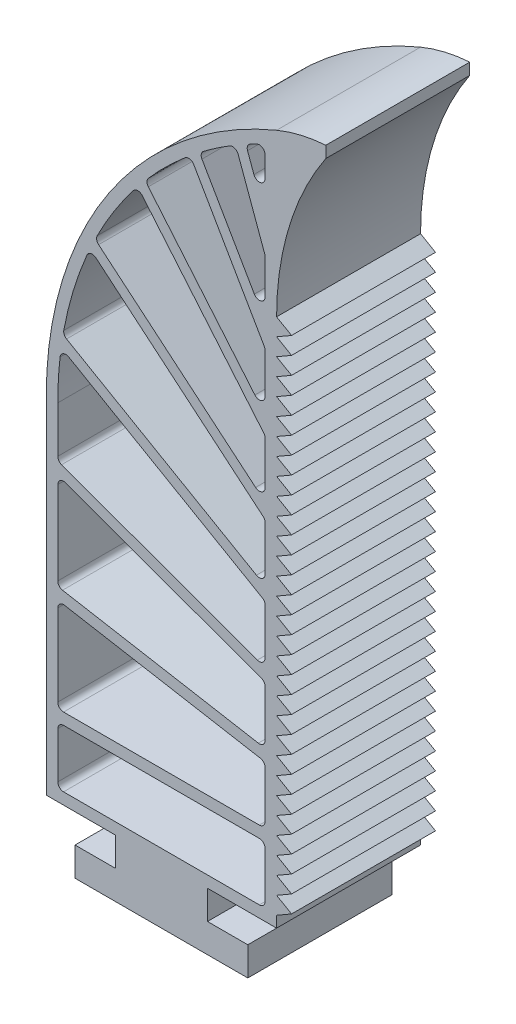
from build123d import *

# Parameters (mm, degrees)
BOSS_EXTRUDE1_DEPTH = 25
SKETCH3_W           = 36
SKETCH3_H           = 10
CUT_EXTRUDE1_DEPTH  = 134.88427839
CUT_EXTRUDE2_DEPTH  = 134.88427839
CUT_EXTRUDE3_DEPTH  = 134.88427839
CUT_EXTRUDE4_DEPTH  = 134.88427839
BOSS_EXTRUDE2_DEPTH = 25
BOSS_EXTRUDE3_DEPTH = 25
LPATTERN1_COUNT     = 30
LPATTERN1_PITCH     = 3
CUT_EXTRUDE5_DEPTH  = 138.359842306
CUT_EXTRUDE6_DEPTH  = 138.359842306
CUT_EXTRUDE7_DEPTH  = 138.359842306
CUT_EXTRUDE8_DEPTH  = 138.359842306
CUT_EXTRUDE9_DEPTH  = 138.359842306
FILLET1_R           = 1


with BuildPart() as part:
    # Sketch2 → Boss-Extrude1 (new body)
    with BuildSketch(Plane.XY):
        with BuildLine():
            Line((-15, 0), (15, 0))
            Line((15, 0), (15, 5))
            Line((15, 5), (8, 5))
            Line((8, 5), (8, 10))
            Line((8, 10), (20, 10))
            Line((20, 10), (20, 130))
            ThreePointArc((20, 130), (-9.083269132, 106.055512755), (-20, 70))
            Line((-20, 70), (-20, 10))
            Line((-20, 10), (-8, 10))
            Line((-8, 10), (-8, 5))
            Line((-8, 5), (-15, 5))
            Line((-15, 5), (-15, 0))
        make_face()
    extrude(amount=BOSS_EXTRUDE1_DEPTH)

    # Sketch3 → Cut-Extrude1 (cut, through all)
    with BuildSketch(Plane.XY.offset(25)):
        with Locations((0, 17)):
            Rectangle(SKETCH3_W, SKETCH3_H)
    extrude(amount=-CUT_EXTRUDE1_DEPTH, mode=Mode.SUBTRACT)

    # Sketch4 → Cut-Extrude2 (cut, through all)
    with BuildSketch(Plane.XY.offset(25)):
        Polygon((-18, 24), (18, 24), (18, 34), (-18, 40.347771306), align=None)
    extrude(amount=-CUT_EXTRUDE2_DEPTH, mode=Mode.SUBTRACT)

    # Sketch5 → Cut-Extrude3 (cut, through all)
    with BuildSketch(Plane.XY.offset(25)):
        Polygon((-18, 42.378624529), (18, 36.030853224), (18, 46.030853224), (-18, 59.133781657), align=None)
    extrude(amount=-CUT_EXTRUDE3_DEPTH, mode=Mode.SUBTRACT)

    # Sketch6 → Cut-Extrude4 (cut, through all)
    with BuildSketch(Plane.XY.offset(25)):
        with BuildLine():
            Line((-18, 61.262137202), (18, 48.159208769))
            Line((18, 48.159208769), (18, 58.159208769))
            Line((18, 58.159208769), (-17.409830527, 78.603083956))
            ThreePointArc((-17.409830527, 78.603083956), (-17.852284458, 74.311651469), (-18, 70))
            Line((-18, 70), (-18, 61.262137202))
        make_face()
    extrude(amount=-CUT_EXTRUDE4_DEPTH, mode=Mode.SUBTRACT)

    # Sketch13 → Boss-Extrude2 (add)
    with BuildSketch(Plane.XY.offset(25)):
        with BuildLine():
            Line((28.543587015, 132.015112463), (28.543587015, 130.015112463))
            ThreePointArc((28.543587015, 130.015112463), (22.183163486, 116.610368534), (20, 101.934676234))
            Line((20, 101.934676234), (20, 130))
            ThreePointArc((20, 130), (24.189413282, 131.356828362), (28.543587015, 132.015112463))
        make_face()
    extrude(amount=-BOSS_EXTRUDE2_DEPTH)

    # Sketch15 → Boss-Extrude3 (add)
    with BuildSketch(Plane.XY.offset(25)):
        Polygon((20, 101.934676234), (22.598076211, 100.434676234), (20, 98.934676234), align=None)
    boss_extrude3 = extrude(amount=-BOSS_EXTRUDE3_DEPTH)

    # LPattern1: Boss-Extrude3 ×30
    with Locations(*[(0, -i * LPATTERN1_PITCH, 0) for i in range(1, LPATTERN1_COUNT)]):
        add(boss_extrude3)

    # Sketch17 → Cut-Extrude5 (cut, through all)
    with BuildSketch(Plane.XY.offset(25)):
        with BuildLine():
            Line((-17.080813578, 80.722527008), (18, 60.468609845))
            Line((18, 60.468609845), (18, 70.468609845))
            Line((18, 70.468609845), (-12.396357526, 95.974182235))
            ThreePointArc((-12.396357526, 95.974182235), (-15.223349712, 88.497247077), (-17.080813578, 80.722527008))
        make_face()
    extrude(amount=-CUT_EXTRUDE5_DEPTH, mode=Mode.SUBTRACT)

    # Sketch18 → Cut-Extrude6 (cut, through all)
    with BuildSketch(Plane.XY.offset(25)):
        with BuildLine():
            Line((-11.513032555, 97.843799156), (18, 73.079424424))
            Line((18, 73.079424424), (18, 83.079424424))
            Line((18, 83.079424424), (-4.123287406, 109.44493167))
            ThreePointArc((-4.123287406, 109.44493167), (-8.135718614, 103.846645438), (-11.513032555, 97.843799156))
        make_face()
    extrude(amount=-CUT_EXTRUDE6_DEPTH, mode=Mode.SUBTRACT)

    # Sketch19 → Cut-Extrude7 (cut, through all)
    with BuildSketch(Plane.XY.offset(25)):
        with BuildLine():
            Line((-2.825102167, 111.009262402), (18, 86.190872078))
            Line((18, 86.190872078), (18, 96.190872078))
            Line((18, 96.190872078), (5.013768012, 118.68368568))
            ThreePointArc((5.013768012, 118.68368568), (0.926972027, 115.017421131), (-2.825102167, 111.009262402))
        make_face()
    extrude(amount=-CUT_EXTRUDE7_DEPTH, mode=Mode.SUBTRACT)

    # Sketch21 → Cut-Extrude8 (cut, through all)
    with BuildSketch(Plane.XY.offset(25)):
        with BuildLine():
            Line((6.596754137, 119.941873284), (18, 100.190872078))
            Line((18, 100.190872078), (18, 110.190872078))
            Line((18, 110.190872078), (12.898276405, 124.207742456))
            ThreePointArc((12.898276405, 124.207742456), (9.683048128, 122.170038436), (6.596754137, 119.941873284))
        make_face()
    extrude(amount=-CUT_EXTRUDE8_DEPTH, mode=Mode.SUBTRACT)

    # Sketch22 → Cut-Extrude9 (cut, through all)
    with BuildSketch(Plane.XY.offset(25)):
        with BuildLine():
            Line((14.660598632, 125.213410732), (18, 116.038480878))
            Line((18, 116.038480878), (18, 126.920997883))
            ThreePointArc((18, 126.920997883), (16.317589, 126.092060929), (14.660598632, 125.213410732))
        make_face()
    extrude(amount=-CUT_EXTRUDE9_DEPTH, mode=Mode.SUBTRACT)

    # Fillet1
    fillet1_edges = [part.edges().sort_by_distance(p)[0] for p in [
        (18, 70.468609845, 12.5),
        (18, 60.468609845, 12.5),
        (-17.080813578, 80.722527008, 12.5),
        (-12.396357526, 95.974182235, 12.5),
        (-11.513032555, 97.843799156, 12.5),
        (-4.123287406, 109.44493167, 12.5),
        (18, 83.079424424, 12.5),
        (18, 73.079424424, 12.5),
        (18, 96.190872078, 12.5),
        (18, 86.190872078, 12.5),
        (-2.825102167, 111.009262402, 12.5),
        (5.013768012, 118.68368568, 12.5),
        (6.596754137, 119.941873284, 12.5),
        (12.898276405, 124.207742456, 12.5),
        (18, 110.190872078, 12.5),
        (18, 100.190872078, 12.5),
        (14.660598632, 125.213410732, 12.5),
        (18, 126.920997883, 12.5),
        (18, 116.038480878, 12.5),
        (-18, 12, 12.5),
        (-18, 22, 12.5),
        (18, 22, 12.5),
        (18, 12, 12.5),
        (-18, 24, 12.5),
        (-18, 40.347771306, 12.5),
        (18, 34, 12.5),
        (18, 24, 12.5),
        (-18, 42.378624529, 12.5),
        (-18, 59.133781657, 12.5),
        (18, 46.030853224, 12.5),
        (18, 36.030853224, 12.5),
        (-18, 61.262137202, 12.5),
        (-17.409830527, 78.603083956, 12.5),
        (18, 58.159208769, 12.5),
        (18, 48.159208769, 12.5),
    ]]
    fillet(fillet1_edges, radius=FILLET1_R)


solid = part.part
